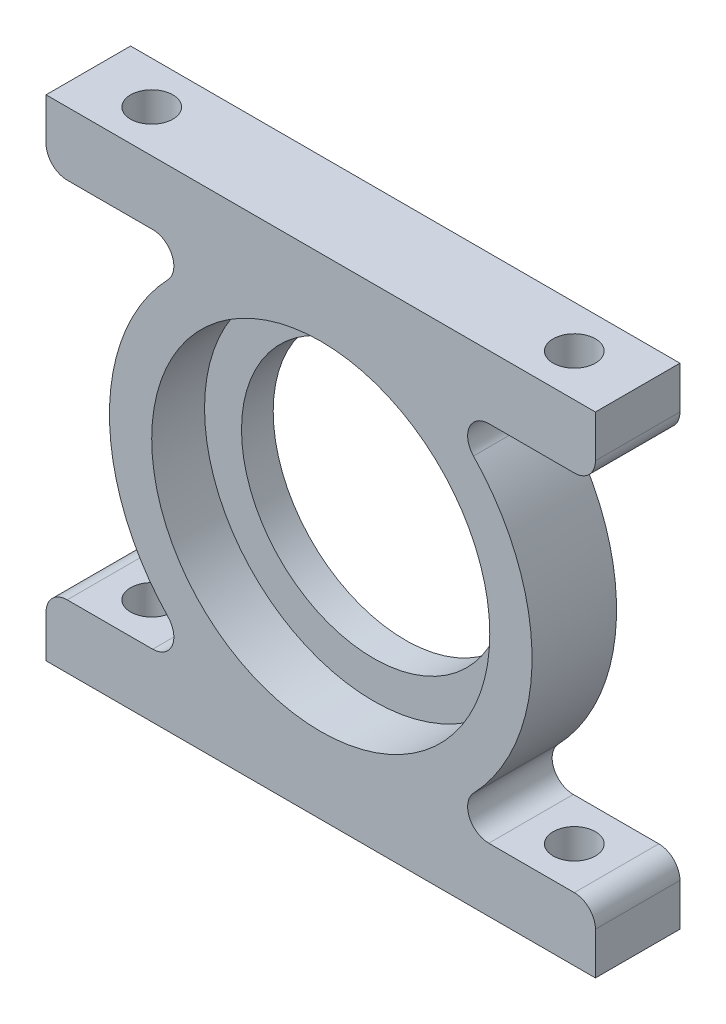
from build123d import *

# Parameters (mm, degrees)
SKETCH_1_R          = 16
EXTRUDE_1_DEPTH     = 8
SKETCH_2_R          = 2
CUT_EXTRUDE_1_DEPTH = 6
CUT_EXTRUDE_START   = -6
SKETCH_3_R          = 2
CUT_EXTRUDE_2_DEPTH = 6
FILLET_1_R          = 2
FILLET_2_R          = 2
SKETCH_4_R          = 16
SKETCH_4_R_2        = 12.5
EXTRUDE_2_DEPTH     = 3


with BuildPart() as part:
    # 草图1 → 凸台-拉伸1 (new body)
    with BuildSketch(Plane.XY):
        with BuildLine():
            Line((-26, 23.2), (26, 23.2))
            Line((26, 23.2), (26, 17.2))
            Line((26, 17.2), (10.205880658, 17.2))
            ThreePointArc((10.205880658, 17.2), (20, 0), (10.205880658, -17.2))
            Line((10.205880658, -17.2), (26, -17.2))
            Line((26, -17.2), (26, -23.2))
            Line((26, -23.2), (-26, -23.2))
            Line((-26, -23.2), (-26, -17.2))
            Line((-26, -17.2), (-10.205880658, -17.2))
            ThreePointArc((-10.205880658, -17.2), (-20, 0), (-10.205880658, 17.2))
            Line((-10.205880658, 17.2), (-26, 17.2))
            Line((-26, 17.2), (-26, 23.2))
        make_face()
        Circle(SKETCH_1_R, mode=Mode.SUBTRACT)
    extrude(amount=EXTRUDE_1_DEPTH)

    # 草图2 → 切除-拉伸1 (cut)
    with BuildSketch(Plane(origin=(0, 23.2, 0), x_dir=(1, 0, 0), z_dir=(0, 1, 0))):
        with Locations(Location((-20, -4, 0), (0, 0, 270))):
            Circle(SKETCH_2_R)
        with Locations(Location((20, -4, 0), (0, 0, 90))):
            Circle(SKETCH_2_R)
    extrude(amount=-CUT_EXTRUDE_1_DEPTH, mode=Mode.SUBTRACT)

    # 草图3 → 切除-拉伸2 (cut)
    with BuildSketch(Plane.XZ.offset(23.2).offset(CUT_EXTRUDE_START)):
        with Locations(Location((20, 4, 0), (0, 0, 270))):
            Circle(SKETCH_3_R)
        with Locations(Location((-20, 4, 0), (0, 0, 90))):
            Circle(SKETCH_3_R)
    extrude(amount=CUT_EXTRUDE_2_DEPTH, mode=Mode.SUBTRACT)

    # 圆角1
    fillet_1_edges = [part.edges().sort_by_distance(p)[0] for p in [
        (-10.205880658, -17.2, 4),
        (-10.205880658, 17.2, 4),
        (10.205880658, 17.2, 4),
        (10.205880658, -17.2, 4),
    ]]
    fillet(fillet_1_edges, radius=FILLET_1_R)

    # 圆角2
    fillet_2_edges = [part.edges().sort_by_distance(p)[0] for p in [
        (-26, -17.2, 4),
        (-26, 17.2, 4),
        (26, 17.2, 4),
        (26, -17.2, 4),
    ]]
    fillet(fillet_2_edges, radius=FILLET_2_R)

    # 草图4 → 凸台-拉伸2 (add)
    with BuildSketch(Plane(origin=(0, 0, 0), x_dir=(-1, 0, 0), z_dir=(0, 0, -1))):
        Circle(SKETCH_4_R)
        Circle(SKETCH_4_R_2, mode=Mode.SUBTRACT)
    extrude(amount=-EXTRUDE_2_DEPTH)


solid = part.part
